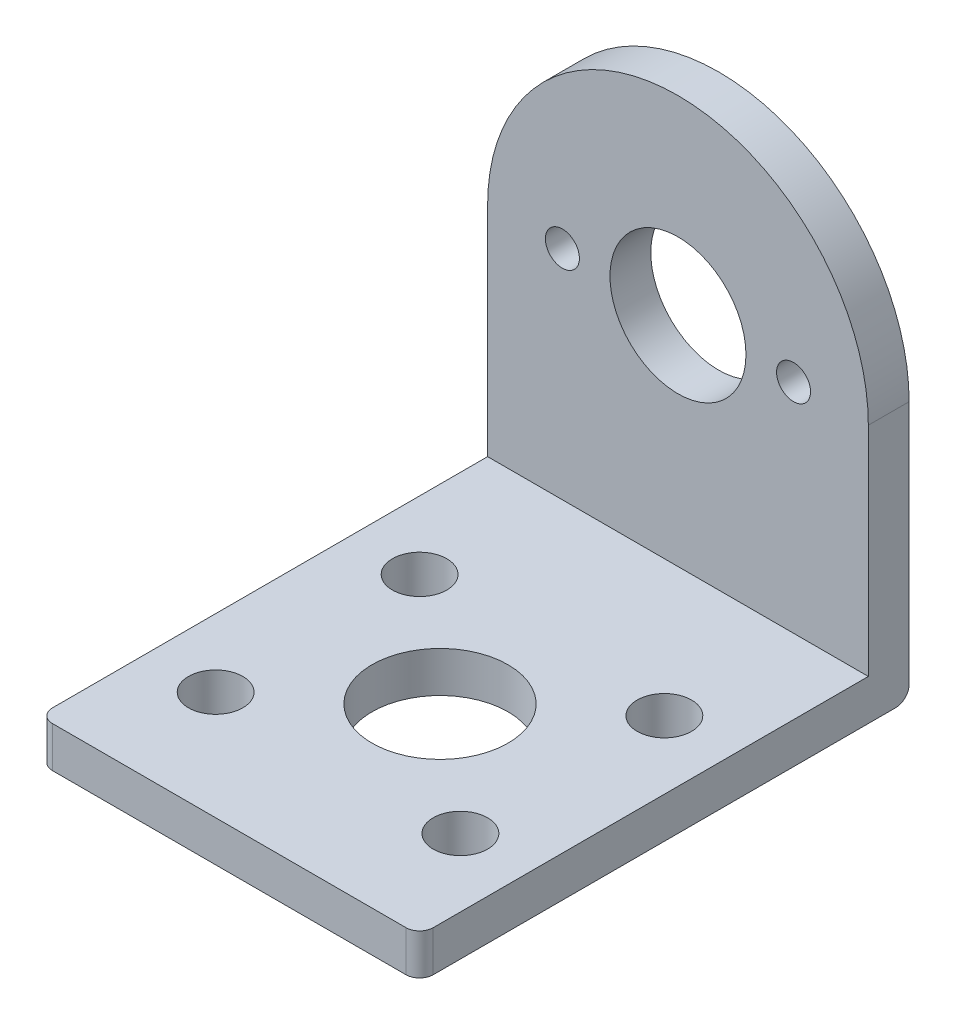
from build123d import *

# Parameters (mm, degrees)
SKETCH1_R           = 5
SKETCH1_R_2         = 1.25
BOSS_EXTRUDE1_DEPTH = 3
SKETCH2_W           = 28
SKETCH2_H           = 3
BOSS_EXTRUDE2_DEPTH = 33
FILLET1_R           = 1
SKETCH4_R           = 2
SKETCH4_R_2         = 5
CUT_EXTRUDE1_DEPTH  = 10


with BuildPart() as part:
    # Sketch1 → Boss-Extrude1 (new body)
    with BuildSketch(Plane.XY):
        with BuildLine():
            Line((-14, 0), (-14, -19))
            Line((-14, -19), (14, -19))
            Line((14, -19), (14, 0))
            ThreePointArc((14, 0), (0, 14), (-14, 0))
        make_face()
        Circle(SKETCH1_R, mode=Mode.SUBTRACT)
        with Locations((-8.5, 0)):
            Circle(SKETCH1_R_2, mode=Mode.SUBTRACT)
        with Locations((8.5, 0)):
            Circle(SKETCH1_R_2, mode=Mode.SUBTRACT)
    extrude(amount=BOSS_EXTRUDE1_DEPTH)

    # Sketch2 → Boss-Extrude2 (add)
    with BuildSketch(Plane.XY.offset(3)):
        with Locations((0, -17.5)):
            Rectangle(SKETCH2_W, SKETCH2_H)
    extrude(amount=BOSS_EXTRUDE2_DEPTH)

    # Fillet1
    fillet1_edges = [part.edges().sort_by_distance(p)[0] for p in [
        (-14, -17.5, 36),
        (14, -17.5, 36),
        (0, -19, 0),
    ]]
    fillet(fillet1_edges, radius=FILLET1_R)

    # Sketch4 → Cut-Extrude1 (cut)
    with BuildSketch(Plane.XZ.offset(19)):
        with Locations(Location((-9, 28, 0), (0, 0, 270))):
            Circle(SKETCH4_R)
        with Locations(Location((-9, 13, 0), (0, 0, 270))):
            Circle(SKETCH4_R)
        with Locations(Location((9, 28, 0), (0, 0, 270))):
            Circle(SKETCH4_R)
        with Locations(Location((9, 13, 0), (0, 0, 270))):
            Circle(SKETCH4_R)
        with Locations(Location((0, 20.5, 0), (0, 0, 270))):
            Circle(SKETCH4_R_2)
    extrude(amount=-CUT_EXTRUDE1_DEPTH, mode=Mode.SUBTRACT)


solid = part.part
